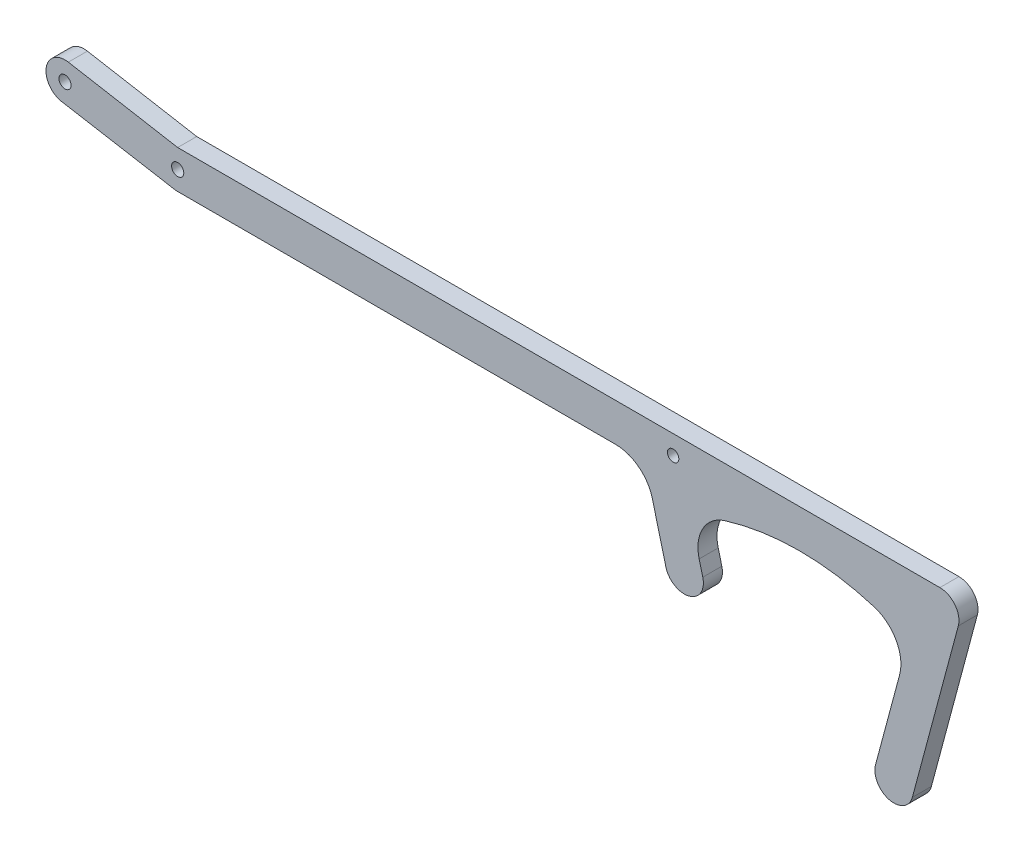
from build123d import *

# Parameters (mm, degrees)
SKETCH1_R           = 2.032
SKETCH1_R_2         = 1.905
BOSS_EXTRUDE1_DEPTH = 3.175
FILLET1_R           = 12.7
FILLET2_R           = 12.7


with BuildPart() as part:
    # Sketch1 → Boss-Extrude1 (new, symmetric)
    with BuildSketch(Plane.XY):
        with BuildLine():
            Line((0, 6.35), (254, 6.35))
            ThreePointArc((254, 6.35), (259.037793711, 3.865635074), (260.133628997, -1.643500936))
            Line((260.133628997, -1.643500936), (244.820332649, -58.793500936))
            ThreePointArc((244.820332649, -58.793500936), (237.043202716, -63.283628997), (232.553074656, -55.506499064))
            Line((232.553074656, -55.506499064), (243.512598299, -14.605))
            ThreePointArc((243.512598299, -14.605), (207.240366893, -6.419077966), (170.968135487, -14.605))
            Line((170.968135487, -14.605), (174.985064715, -30.1625))
            ThreePointArc((174.985064715, -30.1625), (170.424203653, -37.898361062), (162.68834259, -33.3375))
            Line((162.68834259, -33.3375), (155.720200053, -6.35))
            Line((155.720200053, -6.35), (0, -6.35))
            ThreePointArc((0, -6.35), (-0.545429878, -6.326531929), (-1.0868282, -6.256301181))
            Line((-1.0868282, -6.256301181), (-38.624635284, 0.264668019))
            ThreePointArc((-38.624635284, 0.264668019), (-43.792727303, 7.615717142), (-36.435141156, 12.774498432))
            Line((-36.435141156, 12.774498432), (0, 6.35))
        make_face()
        Circle(SKETCH1_R, mode=Mode.SUBTRACT)
        with Locations((165.1, 0)):
            Circle(SKETCH1_R_2, mode=Mode.SUBTRACT)
        with Locations((-37.537807084, 6.5209692)):
            Circle(SKETCH1_R, mode=Mode.SUBTRACT)
    extrude(amount=BOSS_EXTRUDE1_DEPTH, both=True)

    # Fillet1
    fillet1_edges = [part.edges().sort_by_distance(p)[0] for p in [
        (155.720200053, -6.35, 0),
    ]]
    fillet(fillet1_edges, radius=FILLET1_R)

    # Fillet2
    fillet2_edges = [part.edges().sort_by_distance(p)[0] for p in [
        (243.512598299, -14.605, 0),
        (170.968135487, -14.605, 0),
    ]]
    fillet(fillet2_edges, radius=FILLET2_R)


solid = part.part
